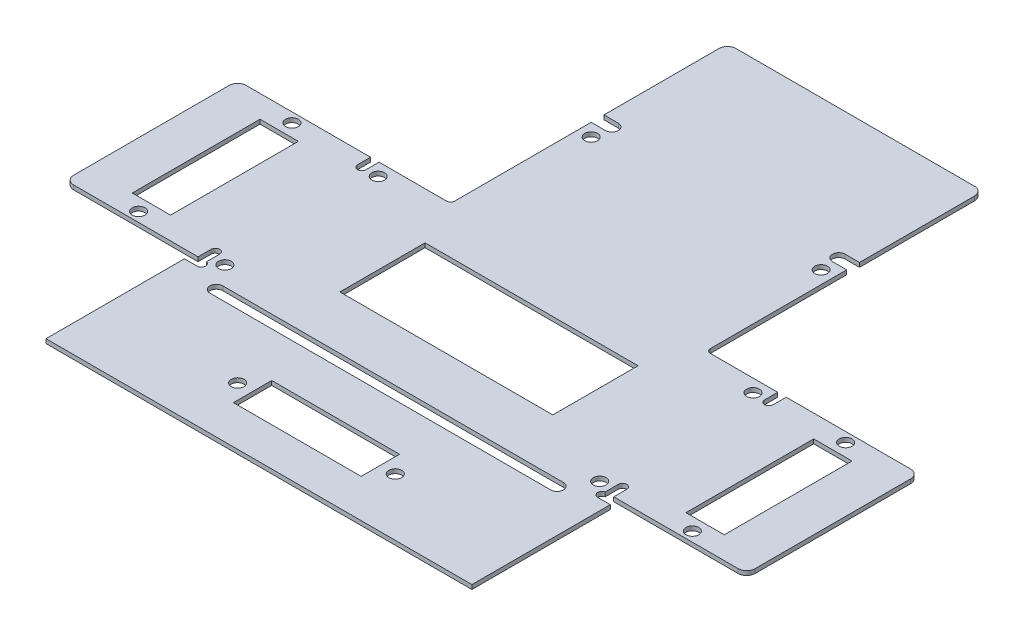
from build123d import *

# Parameters (mm, degrees)
BOSS_EXTRUDE1_DEPTH = 1
CUT_EXTRUDE2_DEPTH  = 1
SKETCH3_R           = 1.5
CUT_EXTRUDE3_DEPTH  = 1
BOSS_EXTRUDE2_START = -1
BOSS_EXTRUDE2_DEPTH = 1
BOSS_EXTRUDE3_DEPTH = 1
SKETCH6_R           = 1.5
SKETCH6_W           = 9
SKETCH6_H           = 30
SKETCH6_W_2         = 30
SKETCH6_H_2         = 9
CUT_EXTRUDE4_DEPTH  = 1
CUT_EXTRUDE5_DEPTH  = 1
SKETCH8_W           = 50
SKETCH8_H           = 20
CUT_EXTRUDE6_DEPTH  = 1


with BuildPart() as part:
    # Sketch1 → Boss-Extrude1 (new body)
    with BuildSketch(Plane(origin=(0, 0, 0), x_dir=(1, 0, 0), z_dir=(0, 1, 0))):
        with BuildLine():
            Line((1, 0), (99, 0))
            ThreePointArc((99, 0), (99.707106781, 0.292893219), (100, 1))
            Line((100, 1), (100, 99))
            ThreePointArc((100, 99), (99.707106781, 99.707106781), (99, 100))
            Line((99, 100), (1, 100))
            ThreePointArc((1, 100), (0.292893219, 99.707106781), (0, 99))
            Line((0, 99), (0, 1))
            ThreePointArc((0, 1), (0.292893219, 0.292893219), (1, 0))
        make_face()
        with BuildLine():
            Line((10, 21.5), (90, 21.5))
            ThreePointArc((90, 21.5), (91.5, 20), (90, 18.5))
            Line((90, 18.5), (10, 18.5))
            ThreePointArc((10, 18.5), (8.5, 20), (10, 21.5))
        make_face(mode=Mode.SUBTRACT)
    extrude(amount=BOSS_EXTRUDE1_DEPTH)

    # Sketch2 → Cut-Extrude2 (cut)
    with BuildSketch(Plane(origin=(0, 1, 0), x_dir=(1, 0, 0), z_dir=(0, 1, 0))):
        with BuildLine():
            Line((0, 100), (0, 65))
            Line((0, 65), (19, 65))
            ThreePointArc((19, 65), (19.707106781, 65.292893219), (20, 66))
            Line((20, 66), (20, 100))
            Line((20, 100), (0, 100))
        make_face()
        with BuildLine():
            Line((100, 65), (100, 100))
            Line((100, 100), (80, 100))
            Line((80, 100), (80, 66))
            ThreePointArc((80, 66), (80.292893219, 65.292893219), (81, 65))
            Line((81, 65), (100, 65))
        make_face()
    extrude(amount=-CUT_EXTRUDE2_DEPTH, mode=Mode.SUBTRACT)

    # Sketch3 → Cut-Extrude3 (cut)
    with BuildSketch(Plane(origin=(0, 1, 0), x_dir=(1, 0, 0), z_dir=(0, 1, 0))):
        with Locations(Location((6, 26, 0), (0, 0, 270))):
            Circle(SKETCH3_R)
        with Locations(Location((23, 95, 0), (0, 0, 270))):
            Circle(SKETCH3_R)
        with Locations(Location((77, 95, 0), (0, 0, 270))):
            Circle(SKETCH3_R)
        with Locations(Location((94, 26, 0), (0, 0, 270))):
            Circle(SKETCH3_R)
        with Locations(Location((6, 62, 0), (0, 0, 270))):
            Circle(SKETCH3_R)
        with Locations(Location((94, 62, 0), (0, 0, 270))):
            Circle(SKETCH3_R)
    extrude(amount=-CUT_EXTRUDE3_DEPTH, mode=Mode.SUBTRACT)

    # Sketch4 → Boss-Extrude2 (add)
    with BuildSketch(Plane(origin=(0, 1, 0), x_dir=(1, 0, 0), z_dir=(0, 1, 0)).offset(BOSS_EXTRUDE2_START)):
        with BuildLine():
            Line((0, 1), (0, -10))
            Line((0, -10), (100, -10))
            Line((100, -10), (100, 1))
            ThreePointArc((100, 1), (99.707106781, 0.292893219), (99, 0))
            Line((99, 0), (1, 0))
            ThreePointArc((1, 0), (0.292893219, 0.292893219), (0, 1))
        make_face()
    extrude(amount=BOSS_EXTRUDE2_DEPTH)

    # Sketch5 → Boss-Extrude3 (add)
    with BuildSketch(Plane(origin=(0, 1, 0), x_dir=(1, 0, 0), z_dir=(0, 1, 0))):
        with BuildLine():
            Line((100, 65), (128, 65))
            ThreePointArc((128, 65), (129.414213562, 64.414213562), (130, 63))
            Line((130, 63), (130, 26.5))
            ThreePointArc((130, 26.5), (129.414213562, 25.085786438), (128, 24.5))
            Line((128, 24.5), (100, 24.5))
            Line((100, 24.5), (100, 65))
        make_face()
        with BuildLine():
            Line((0, 24.5), (-28, 24.5))
            ThreePointArc((-28, 24.5), (-29.414213562, 25.085786438), (-30, 26.5))
            Line((-30, 26.5), (-30, 63))
            ThreePointArc((-30, 63), (-29.414213562, 64.414213562), (-28, 65))
            Line((-28, 65), (0, 65))
            Line((0, 65), (0, 24.5))
        make_face()
        with BuildLine():
            Line((80, 100), (20, 100))
            Line((20, 100), (20, 128))
            ThreePointArc((20, 128), (20.585786438, 129.414213562), (22, 130))
            Line((22, 130), (78, 130))
            ThreePointArc((78, 130), (79.414213562, 129.414213562), (80, 128))
            Line((80, 128), (80, 100))
        make_face()
    extrude(amount=-BOSS_EXTRUDE3_DEPTH)

    # Sketch6 → Cut-Extrude4 (cut)
    with BuildSketch(Plane(origin=(0, 1, 0), x_dir=(1, 0, 0), z_dir=(0, 1, 0))):
        with Locations(Location((31.5, 3.5, 0), (0, 0, 270))):
            Circle(SKETCH6_R)
        with Locations(Location((-15, 62.75, 0), (0, 0, 270))):
            Circle(SKETCH6_R)
        with Locations(Location((-15, 26.75, 0), (0, 0, 90))):
            Circle(SKETCH6_R)
        with Locations(Location((68.5, 3.5, 0), (0, 0, 90))):
            Circle(SKETCH6_R)
        with Locations(Location((115, 26.75, 0), (0, 0, 270))):
            Circle(SKETCH6_R)
        with Locations(Location((115, 62.75, 0), (0, 0, 90))):
            Circle(SKETCH6_R)
        with Locations((115, 44.75)):
            Rectangle(SKETCH6_W, SKETCH6_H)
        with Locations((-15, 44.75)):
            Rectangle(SKETCH6_W, SKETCH6_H)
        with Locations((50, 3.5)):
            Rectangle(SKETCH6_W_2, SKETCH6_H_2)
    extrude(amount=-CUT_EXTRUDE4_DEPTH, mode=Mode.SUBTRACT)

    # Sketch7 → Cut-Extrude5 (cut)
    with BuildSketch(Plane(origin=(0, 1, 0), x_dir=(1, 0, 0), z_dir=(0, 1, 0))):
        with BuildLine():
            Line((0, 24.5), (2.972707359, 24.5))
            ThreePointArc((2.972707359, 24.5), (3.972707359, 23.5), (2.972707359, 22.5))
            Line((2.972707359, 22.5), (0, 22.5))
            ThreePointArc((0, 22.5), (-1, 23.5), (0, 24.5))
        make_face()
        with BuildLine():
            Line((19.996436831, 101), (23.359178087, 101))
            ThreePointArc((23.359178087, 101), (24.859178087, 99.5), (23.359178087, 98))
            Line((23.359178087, 98), (19.996436831, 98))
            ThreePointArc((19.996436831, 98), (18.496436831, 99.5), (19.996436831, 101))
        make_face()
        with BuildLine():
            Line((1.2, 24.5), (1.2, 27.556784127))
            ThreePointArc((1.2, 27.556784127), (2.2, 28.556784127), (3.2, 27.556784127))
            Line((3.2, 27.556784127), (3.2, 24.5))
            ThreePointArc((3.2, 24.5), (2.2, 23.5), (1.2, 24.5))
        make_face()
        with BuildLine():
            Line((1.2, 65), (1.2, 61.943215873))
            ThreePointArc((1.2, 61.943215873), (2.2, 60.943215873), (3.2, 61.943215873))
            Line((3.2, 61.943215873), (3.2, 65))
            ThreePointArc((3.2, 65), (2.2, 66), (1.2, 65))
        make_face()
        with BuildLine():
            Line((80.003563169, 101), (76.640821913, 101))
            ThreePointArc((76.640821913, 101), (75.140821913, 99.5), (76.640821913, 98))
            Line((76.640821913, 98), (80.003563169, 98))
            ThreePointArc((80.003563169, 98), (81.503563169, 99.5), (80.003563169, 101))
        make_face()
        with BuildLine():
            Line((98.8, 24.5), (98.8, 27.556784127))
            ThreePointArc((98.8, 27.556784127), (97.8, 28.556784127), (96.8, 27.556784127))
            Line((96.8, 27.556784127), (96.8, 24.5))
            ThreePointArc((96.8, 24.5), (97.8, 23.5), (98.8, 24.5))
        make_face()
        with BuildLine():
            Line((100, 24.5), (97.027292641, 24.5))
            ThreePointArc((97.027292641, 24.5), (96.027292641, 23.5), (97.027292641, 22.5))
            Line((97.027292641, 22.5), (100, 22.5))
            ThreePointArc((100, 22.5), (101, 23.5), (100, 24.5))
        make_face()
        with BuildLine():
            Line((98.8, 65), (98.8, 61.943215873))
            ThreePointArc((98.8, 61.943215873), (97.8, 60.943215873), (96.8, 61.943215873))
            Line((96.8, 61.943215873), (96.8, 65))
            ThreePointArc((96.8, 65), (97.8, 66), (98.8, 65))
        make_face()
    extrude(amount=-CUT_EXTRUDE5_DEPTH, mode=Mode.SUBTRACT)

    # Sketch8 → Cut-Extrude6 (cut)
    with BuildSketch(Plane(origin=(0, 1, 0), x_dir=(1, 0, 0), z_dir=(0, 1, 0))):
        with Locations((50, 44)):
            Rectangle(SKETCH8_W, SKETCH8_H)
    extrude(amount=-CUT_EXTRUDE6_DEPTH, mode=Mode.SUBTRACT)


solid = part.part
